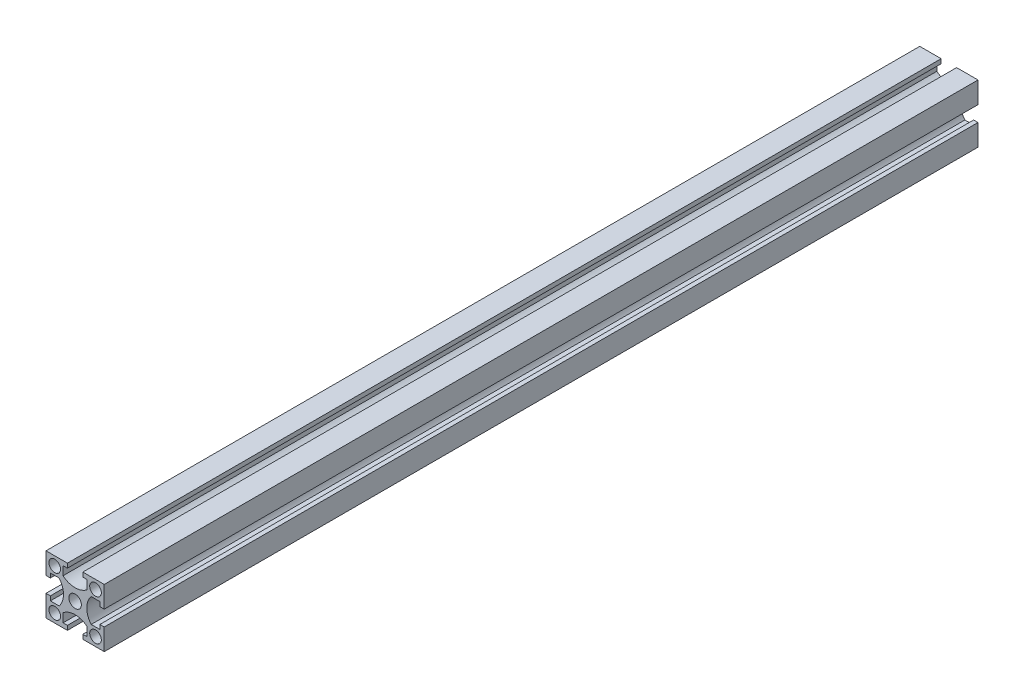
from build123d import *

# Parameters (mm, degrees)
SKETCH_1_W          = 20
SKETCH_1_H          = 20
EXTRUDE_1_DEPTH     = 300
SKETCH_2_R          = 2.15
SKETCH_2_R_2        = 2
CUT_EXTRUDE_1_DEPTH = 300


with BuildPart() as part:
    # 스케치1 → 보스-돌출1 (new body)
    with BuildSketch(Plane.XY):
        Rectangle(SKETCH_1_W, SKETCH_1_H)
    extrude(amount=EXTRUDE_1_DEPTH)

    # 스케치2 → 컷-돌출1 (cut)
    with BuildSketch(Plane.XY.offset(300)):
        Circle(SKETCH_2_R)
        with Locations((-7, 7)):
            Circle(SKETCH_2_R_2)
        with Locations((7, 7)):
            Circle(SKETCH_2_R_2)
        with Locations((7, -7)):
            Circle(SKETCH_2_R_2)
        with Locations((-7, -7)):
            Circle(SKETCH_2_R_2)
        with BuildLine():
            Line((-2.65, 10), (-2.65, 8.5))
            Line((-2.65, 8.5), (-4.15, 8.5))
            Line((-4.15, 8.5), (-4.15, 5.5))
            ThreePointArc((-4.15, 5.5), (0, 4), (4.15, 5.5))
            Line((4.15, 5.5), (4.15, 8.5))
            Line((4.15, 8.5), (2.65, 8.5))
            Line((2.65, 8.5), (2.65, 10))
            Line((2.65, 10), (-2.65, 10))
        make_face()
        with BuildLine():
            Line((10, 2.65), (8.5, 2.65))
            Line((8.5, 2.65), (8.5, 4.15))
            Line((8.5, 4.15), (5.5, 4.15))
            ThreePointArc((5.5, 4.15), (4, 0), (5.5, -4.15))
            Line((5.5, -4.15), (8.5, -4.15))
            Line((8.5, -4.15), (8.5, -2.65))
            Line((8.5, -2.65), (10, -2.65))
            Line((10, -2.65), (10, 2.65))
        make_face()
        with BuildLine():
            Line((2.65, -10), (2.65, -8.5))
            Line((2.65, -8.5), (4.15, -8.5))
            Line((4.15, -8.5), (4.15, -5.5))
            ThreePointArc((4.15, -5.5), (0, -4), (-4.15, -5.5))
            Line((-4.15, -5.5), (-4.15, -8.5))
            Line((-4.15, -8.5), (-2.65, -8.5))
            Line((-2.65, -8.5), (-2.65, -10))
            Line((-2.65, -10), (2.65, -10))
        make_face()
        with BuildLine():
            Line((-10, -2.65), (-8.5, -2.65))
            Line((-8.5, -2.65), (-8.5, -4.15))
            Line((-8.5, -4.15), (-5.5, -4.15))
            ThreePointArc((-5.5, -4.15), (-4, 0), (-5.5, 4.15))
            Line((-5.5, 4.15), (-8.5, 4.15))
            Line((-8.5, 4.15), (-8.5, 2.65))
            Line((-8.5, 2.65), (-10, 2.65))
            Line((-10, 2.65), (-10, -2.65))
        make_face()
    extrude(amount=-CUT_EXTRUDE_1_DEPTH, mode=Mode.SUBTRACT)


solid = part.part
